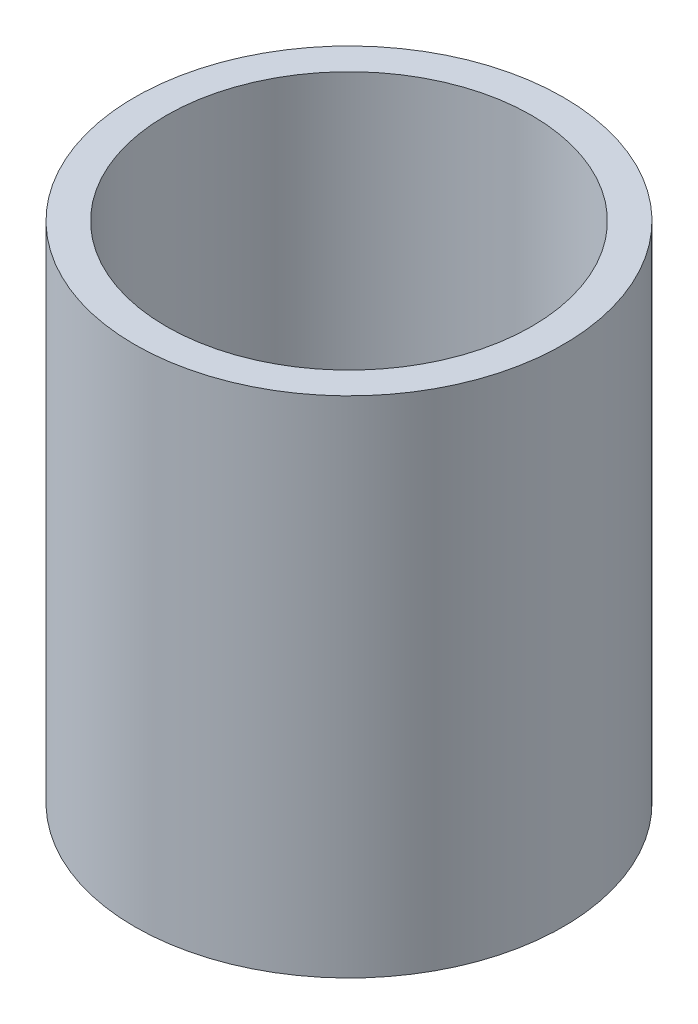
from build123d import *

# Parameters (mm, degrees)
SKETCH1_R           = 43.18
SKETCH1_R_2         = 36.83
BOSS_EXTRUDE1_DEPTH = 101.6


with BuildPart() as part:
    # Sketch1 → Boss-Extrude1 (new body)
    with BuildSketch(Plane(origin=(0, 0, 0), x_dir=(1, 0, 0), z_dir=(0, 1, 0))):
        with Locations(Location((0, 0, 0), (0, 0, 270))):
            Circle(SKETCH1_R)
        with Locations(Location((0, 0, 0), (0, 0, 270))):
            Circle(SKETCH1_R_2, mode=Mode.SUBTRACT)
    extrude(amount=BOSS_EXTRUDE1_DEPTH)


solid = part.part
